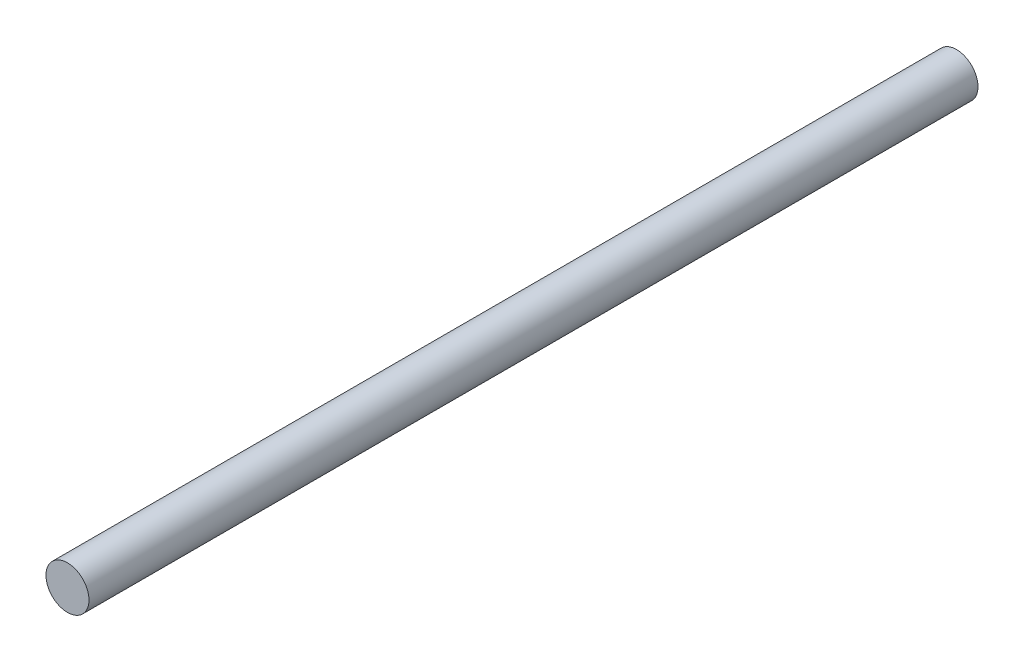
from build123d import *

# Parameters (mm, degrees)
ESQUISSE1_R        = 1.5
BOSS_EXTRU_1_DEPTH = 62


with BuildPart() as part:
    # Esquisse1 → Boss.-Extru.1 (new body)
    with BuildSketch(Plane.XY):
        Circle(ESQUISSE1_R)
    extrude(amount=BOSS_EXTRU_1_DEPTH)


solid = part.part
